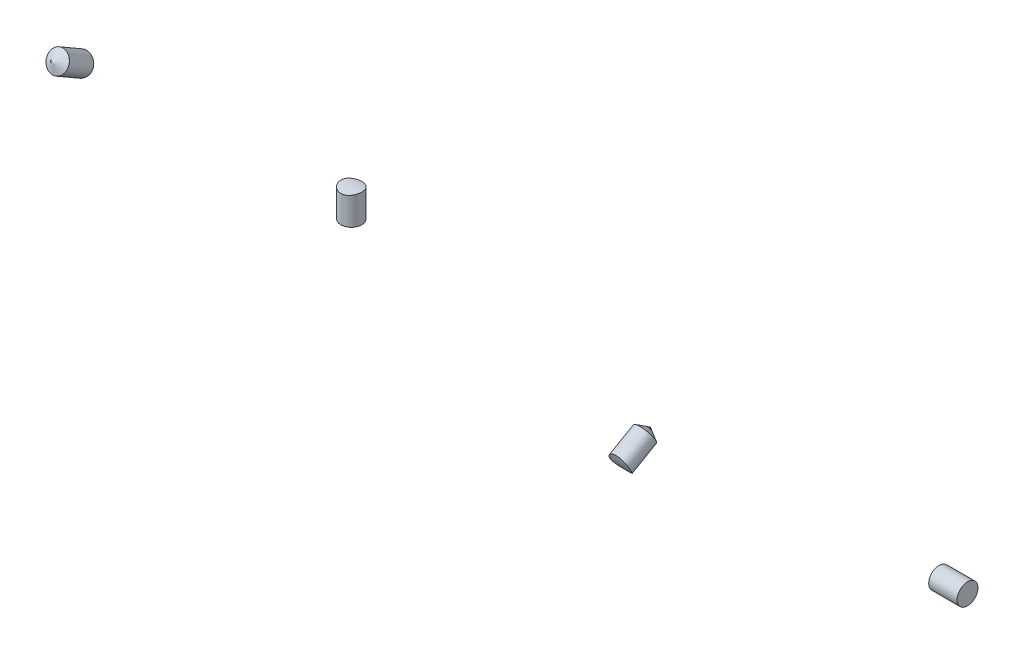
from build123d import *

# Parameters (mm, degrees)
SKETCH1_R                            = 11.11
BOSS_EXTRUDE1_DEPTH                  = 304
F_3_0_3_DIAMETER_HOLE2_D             = 3
F_3_0_3_DIAMETER_HOLE2_DEPTH         = 11
F_3_0_3_DIAMETER_HOLE2_TIP           = 0.901290929
F_13_64_0_20313_DIAMETER_HOLE2_D     = 5.159502
F_13_64_0_20313_DIAMETER_HOLE2_DEPTH = 7
F_13_64_0_20313_DIAMETER_HOLE2_TIP   = 1.550070783
F_13_64_0_20313_DIAMETER_HOLE4_D     = 5.159502
F_13_64_0_20313_DIAMETER_HOLE4_DEPTH = 7
F_13_64_0_20313_DIAMETER_HOLE4_TIP   = 1.550070783
F_13_64_0_20313_DIAMETER_HOLE5_D     = 5.159502
F_13_64_0_20313_DIAMETER_HOLE5_DEPTH = 7
F_13_64_0_20313_DIAMETER_HOLE5_TIP   = 1.550070783
F_13_64_0_20313_DIAMETER_HOLE6_D     = 5.159502
F_13_64_0_20313_DIAMETER_HOLE6_DEPTH = 7
F_13_64_0_20313_DIAMETER_HOLE6_TIP   = 1.550070783
SKETCH22_R                           = 11.11
BOSS_EXTRUDE5_DEPTH                  = 304
SKETCH23_R                           = 11.11
BOSS_EXTRUDE6_DEPTH                  = 264


with BuildPart() as part:
    # Sketch1 → Boss-Extrude1 (new body)
    with BuildSketch(Plane(origin=(0, 0, 0), x_dir=(0, 0, -1), z_dir=(1, 0, 0))):
        Circle(SKETCH1_R)
    extrude(amount=BOSS_EXTRUDE1_DEPTH)

    # Ø3.0 (3) Diameter Hole2
    with Locations(Plane.ZY):
        with Locations((0, 5.3)):
            Hole(F_3_0_3_DIAMETER_HOLE2_D / 2, depth=F_3_0_3_DIAMETER_HOLE2_DEPTH)
            with Locations((0, 0, -(F_3_0_3_DIAMETER_HOLE2_DEPTH + F_3_0_3_DIAMETER_HOLE2_TIP / 2))):  # 118° drill point
                Cone(0, F_3_0_3_DIAMETER_HOLE2_D / 2, F_3_0_3_DIAMETER_HOLE2_TIP, mode=Mode.SUBTRACT)

    # 13/64 (0.20313) Diameter Hole2
    with Locations(Plane(origin=(0, 11.11, 0), x_dir=(1, 0, 0), z_dir=(0, 1, 0))):
        with Locations((152, 0)):
            Hole(F_13_64_0_20313_DIAMETER_HOLE2_D / 2, depth=F_13_64_0_20313_DIAMETER_HOLE2_DEPTH)
            with Locations((0, 0, -(F_13_64_0_20313_DIAMETER_HOLE2_DEPTH + F_13_64_0_20313_DIAMETER_HOLE2_TIP / 2))):  # 118° drill point
                Cone(0, F_13_64_0_20313_DIAMETER_HOLE2_D / 2, F_13_64_0_20313_DIAMETER_HOLE2_TIP, mode=Mode.SUBTRACT)

    # 13/64 (0.20313) Diameter Hole4
    with Locations(Plane(origin=(0, -5.555, -9.621542236), x_dir=(-1, 0, 0), z_dir=(0, -0.50000000000001, -0.8660254037844328))):
        with Locations((-76, 0)):
            Hole(F_13_64_0_20313_DIAMETER_HOLE4_D / 2, depth=F_13_64_0_20313_DIAMETER_HOLE4_DEPTH)
            with Locations((0, 0, -(F_13_64_0_20313_DIAMETER_HOLE4_DEPTH + F_13_64_0_20313_DIAMETER_HOLE4_TIP / 2))):  # 118° drill point
                Cone(0, F_13_64_0_20313_DIAMETER_HOLE4_D / 2, F_13_64_0_20313_DIAMETER_HOLE4_TIP, mode=Mode.SUBTRACT)

    # 13/64 (0.20313) Diameter Hole5
    with Locations(Plane(origin=(0, -5.555, 9.621542236), x_dir=(-1, 0, 0), z_dir=(0, -0.499999999999998, 0.8660254037844398))):
        with Locations((-228, 0)):
            Hole(F_13_64_0_20313_DIAMETER_HOLE5_D / 2, depth=F_13_64_0_20313_DIAMETER_HOLE5_DEPTH)
            with Locations((0, 0, -(F_13_64_0_20313_DIAMETER_HOLE5_DEPTH + F_13_64_0_20313_DIAMETER_HOLE5_TIP / 2))):  # 118° drill point
                Cone(0, F_13_64_0_20313_DIAMETER_HOLE5_D / 2, F_13_64_0_20313_DIAMETER_HOLE5_TIP, mode=Mode.SUBTRACT)

    # 13/64 (0.20313) Diameter Hole6
    with Locations(Plane(origin=(304, 0, 0), x_dir=(0, 0, -1), z_dir=(1, 0, 0))):
        with Locations((0, 0)):
            Hole(F_13_64_0_20313_DIAMETER_HOLE6_D / 2, depth=F_13_64_0_20313_DIAMETER_HOLE6_DEPTH)
            with Locations((0, 0, -(F_13_64_0_20313_DIAMETER_HOLE6_DEPTH + F_13_64_0_20313_DIAMETER_HOLE6_TIP / 2))):  # 118° drill point
                Cone(0, F_13_64_0_20313_DIAMETER_HOLE6_D / 2, F_13_64_0_20313_DIAMETER_HOLE6_TIP, mode=Mode.SUBTRACT)


with BuildPart() as body_2:
    # Sketch22 → Boss-Extrude5 (new body)
    with BuildSketch(Plane(origin=(0, 0, 0), x_dir=(0, 0, -1), z_dir=(1, 0, 0))):
        Circle(SKETCH22_R)
    extrude(amount=BOSS_EXTRUDE5_DEPTH)


with BuildPart() as body_2_2:
    # Sketch23 → Boss-Extrude6 (new body)
    with BuildSketch(Plane(origin=(304, 0, 0), x_dir=(0, 0, -1), z_dir=(1, 0, 0))):
        Circle(SKETCH23_R)
    extrude(amount=-BOSS_EXTRUDE6_DEPTH)

    # Combine3: cut part
    add(part.part, mode=Mode.SUBTRACT)


solid = body_2_2.part
